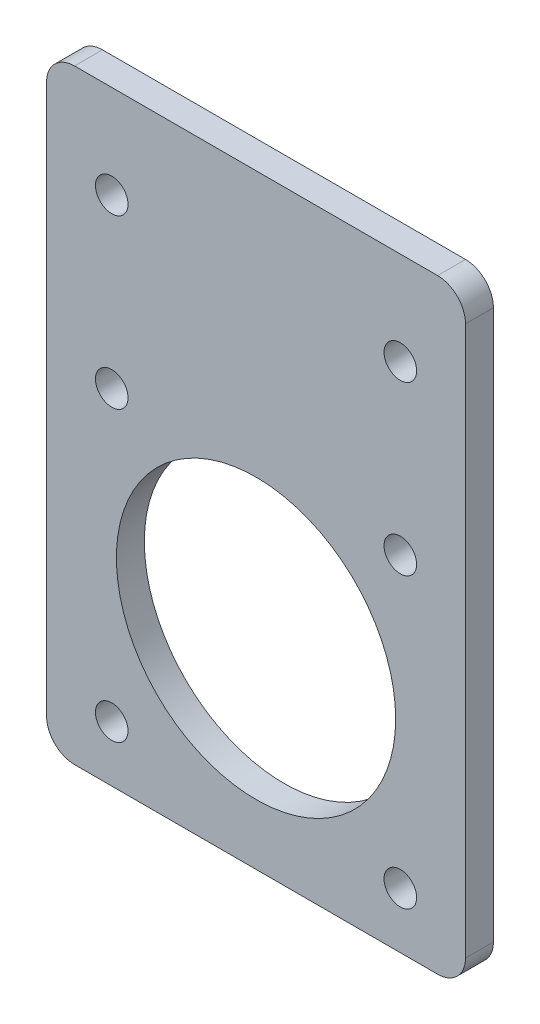
from build123d import *

# Parameters (mm, degrees)
SKIZZE1_W                       = 45
SKIZZE1_H                       = 65
AUFSATZ_LINEAR_AUSTRAGEN1_DEPTH = 3
VERRUNDUNG1_R                   = 3
SKIZZE2_R                       = 1.75
SKIZZE2_R_2                     = 15
SCHNITT_LINEAR_AUSTRAGEN1_DEPTH = 12


with BuildPart() as part:
    # Skizze1 → Aufsatz-Linear austragen1 (new body)
    with BuildSketch(Plane.XY):
        Rectangle(SKIZZE1_W, SKIZZE1_H)
    extrude(amount=AUFSATZ_LINEAR_AUSTRAGEN1_DEPTH)

    # Verrundung1
    verrundung1_edges = [part.edges().sort_by_distance(p)[0] for p in [
        (-22.5, 32.5, 1.5),
        (22.5, 32.5, 1.5),
        (22.5, -32.5, 1.5),
        (-22.5, -32.5, 1.5),
    ]]
    fillet(verrundung1_edges, radius=VERRUNDUNG1_R)

    # Skizze2 → Schnitt-Linear austragen1 (cut)
    with BuildSketch(Plane.XY.offset(3)):
        with Locations((-15.5, -26.5)):
            Circle(SKIZZE2_R)
        with Locations((-15.5, 4.5)):
            Circle(SKIZZE2_R)
        with Locations((15.5, 4.5)):
            Circle(SKIZZE2_R)
        with Locations((15.5, -26.5)):
            Circle(SKIZZE2_R)
        with Locations((15.5, 22.5)):
            Circle(SKIZZE2_R)
        with Locations((-15.5, 22.5)):
            Circle(SKIZZE2_R)
        with Locations((0, -11)):
            Circle(SKIZZE2_R_2)
    extrude(amount=-SCHNITT_LINEAR_AUSTRAGEN1_DEPTH, mode=Mode.SUBTRACT)


solid = part.part
